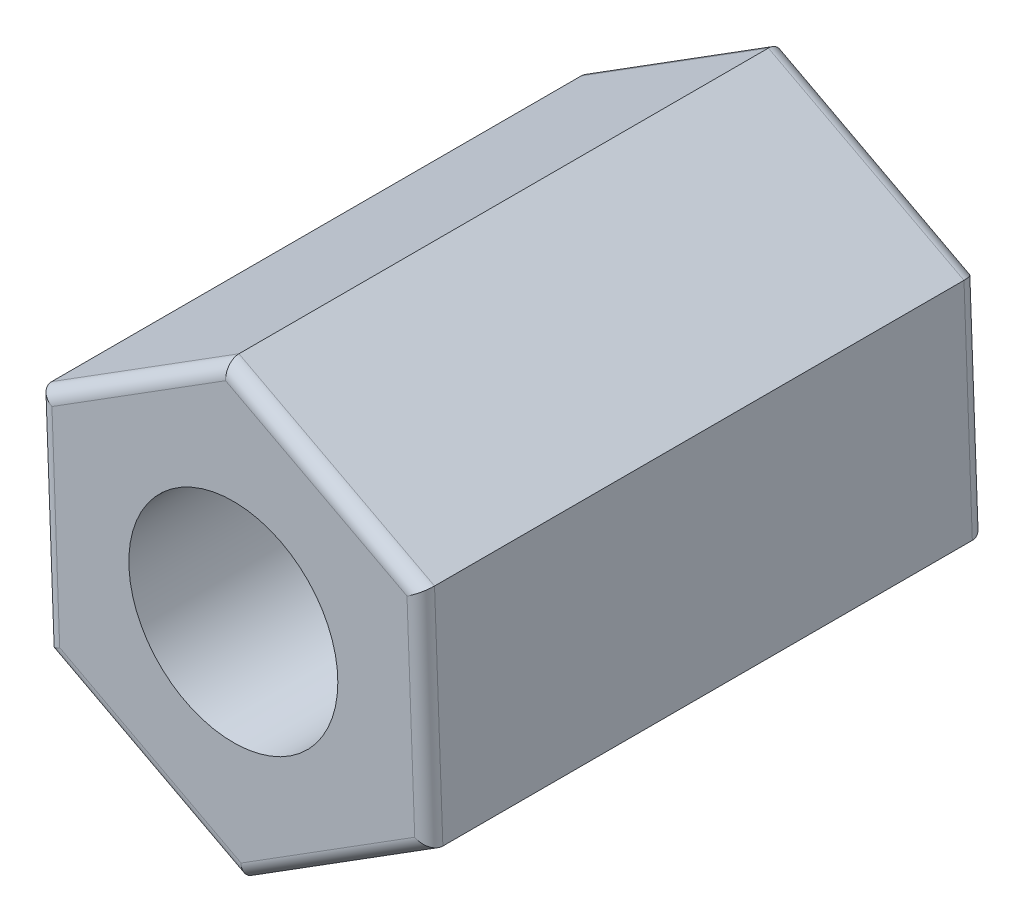
from build123d import *

# Parameters (mm, degrees)
SKETCH2_R           = 1.5
BOSS_EXTRUDE1_DEPTH = 8
FILLET1_R           = 0.2
FILLET2_R           = 0.2


with BuildPart() as part:
    # Sketch2 → Boss-Extrude1 (new body)
    with BuildSketch(Plane.XY):
        Polygon((-2.807865196, 1.482978886), (-2.688229986, -1.690193147), (0.119635209, -3.173172033), (2.807865196, -1.482978886), (2.688229986, 1.690193147), (-0.119635209, 3.173172033), align=None)
        Circle(SKETCH2_R, mode=Mode.SUBTRACT)
    extrude(amount=BOSS_EXTRUDE1_DEPTH)

    # Fillet1
    fillet1_edges = [part.edges().sort_by_distance(p)[0] for p in [
        (1.284297389, 2.43168259, 0),
        (2.748047591, 0.10360713, 0),
        (1.463750202, -2.328075459, 0),
        (-1.284297389, -2.43168259, 0),
        (-2.748047591, -0.10360713, 0),
        (-1.463750202, 2.328075459, 0),
    ]]
    fillet(fillet1_edges, radius=FILLET1_R)

    # Fillet2
    fillet2_edges = [part.edges().sort_by_distance(p)[0] for p in [
        (-1.284297389, -2.43168259, 8),
        (1.463750202, -2.328075459, 8),
        (2.748047591, 0.10360713, 8),
        (1.284297389, 2.43168259, 8),
        (-1.463750202, 2.328075459, 8),
        (-2.748047591, -0.10360713, 8),
    ]]
    fillet(fillet2_edges, radius=FILLET2_R)


solid = part.part
